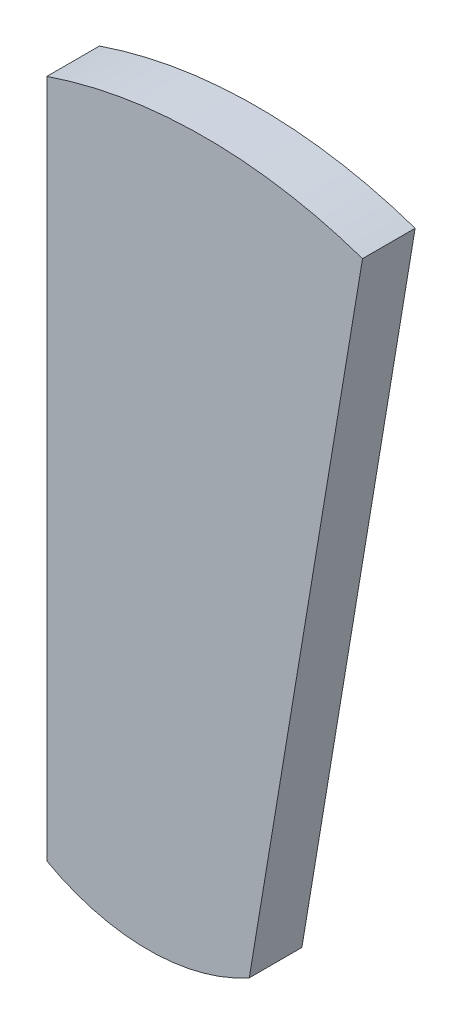
from build123d import *

# Parameters (mm, degrees)
BOSS_EXTRUDE1_DEPTH = 3


with BuildPart() as part:
    # Sketch1 → Boss-Extrude1 (new, symmetric)
    with BuildSketch(Plane.XY):
        with BuildLine():
            ThreePointArc((-36, 34.763358779), (-18, 37.763525749), (0, 34.763358779))
            Line((0, 34.763358779), (-36, 34.763358779))
        make_face()
        Polygon((-36, 34.763358779), (0, 34.763358779), (-12.916030534, -42.732824427), (-36, -42.732824427), align=None)
        with BuildLine():
            Line((-36, -42.732824427), (-12.916030534, -42.732824427))
            ThreePointArc((-12.916030534, -42.732824427), (-24.458015267, -45.732826068), (-36, -42.732824427))
        make_face()
    extrude(amount=BOSS_EXTRUDE1_DEPTH, both=True)


solid = part.part
